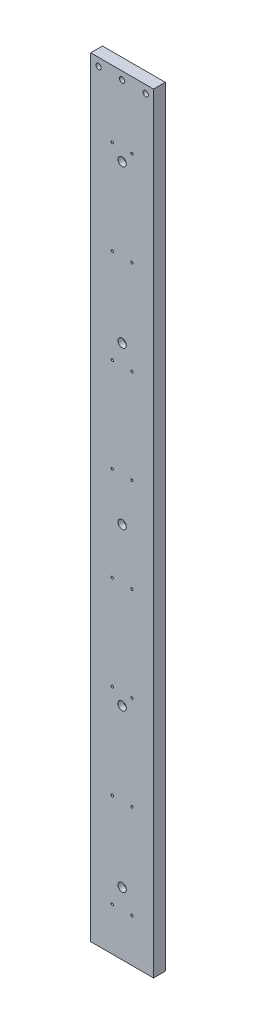
from build123d import *

# Parameters (mm, degrees)
SKETCH1_W                                         = 101.6
SKETCH1_H                                         = 1244.6
EXTRUDE1_DEPTH                                    = 19.05
CBORE_FOR_5_16_SOCKET_HEAD_CAP_SCREW1_D           = 8.72998
CBORE_FOR_5_16_SOCKET_HEAD_CAP_SCREW1_CBORE_D     = 13.49502
CBORE_FOR_5_16_SOCKET_HEAD_CAP_SCREW1_CBORE_DEPTH = 8.6995
F_5_16_18_TAPPED_HOLE1_D                          = 6.5278
F_5_16_18_TAPPED_HOLE1_DEPTH                      = 22.9235
F_5_16_18_TAPPED_HOLE1_TIP                        = 1.961148974
F_10_24_TAPPED_HOLE1_D                            = 3.7973
LPATTERN1_COUNT                                   = 8
LPATTERN1_PITCH                                   = 152.4
F_5_16_CLEARANCE_HOLE1_D                          = 8.72998


with BuildPart() as part:
    # Sketch1 → Extrude1 (new body)
    with BuildSketch(Plane.XY):
        with Locations((50.8, 622.3)):
            Rectangle(SKETCH1_W, SKETCH1_H)
    extrude(amount=EXTRUDE1_DEPTH)

    # CBORE for 5/16 Socket Head Cap Screw1 (through all)
    with Locations(Plane.XY.offset(19.05)):
        with Locations((50.8, 101.6), (50.8, 355.6), (50.8, 609.6), (50.8, 863.6), (50.8, 1117.6)):
            CounterBoreHole(CBORE_FOR_5_16_SOCKET_HEAD_CAP_SCREW1_D / 2, CBORE_FOR_5_16_SOCKET_HEAD_CAP_SCREW1_CBORE_D / 2, CBORE_FOR_5_16_SOCKET_HEAD_CAP_SCREW1_CBORE_DEPTH)

    # 5/16-18 Tapped Hole1
    with Locations(Plane.XZ):
        with Locations((12.7, 9.525), (88.9, 9.525)):
            Hole(F_5_16_18_TAPPED_HOLE1_D / 2, depth=F_5_16_18_TAPPED_HOLE1_DEPTH)
            with Locations((0, 0, -(F_5_16_18_TAPPED_HOLE1_DEPTH + F_5_16_18_TAPPED_HOLE1_TIP / 2))):  # 118° drill point
                Cone(0, F_5_16_18_TAPPED_HOLE1_D / 2, F_5_16_18_TAPPED_HOLE1_TIP, mode=Mode.SUBTRACT)

    # #10-24 Tapped Hole1 (through all)
    with Locations(Plane.XY.offset(19.05)):
        with Locations((34.925, 69.85), (66.675, 69.85)):
            f_10_24_tapped_hole1 = Hole(F_10_24_TAPPED_HOLE1_D / 2)

    # LPattern1: #10-24 Tapped Hole1 ×8
    with Locations(*[(0, i * LPATTERN1_PITCH, 0) for i in range(1, LPATTERN1_COUNT)]):
        add(f_10_24_tapped_hole1, mode=Mode.SUBTRACT)

    # 5/16 Clearance Hole1 (through all)
    with Locations(Plane.XY.offset(19.05)):
        with Locations((50.8, 1231.9), (12.7, 1231.9), (88.9, 1231.9)):
            Hole(F_5_16_CLEARANCE_HOLE1_D / 2)


solid = part.part
